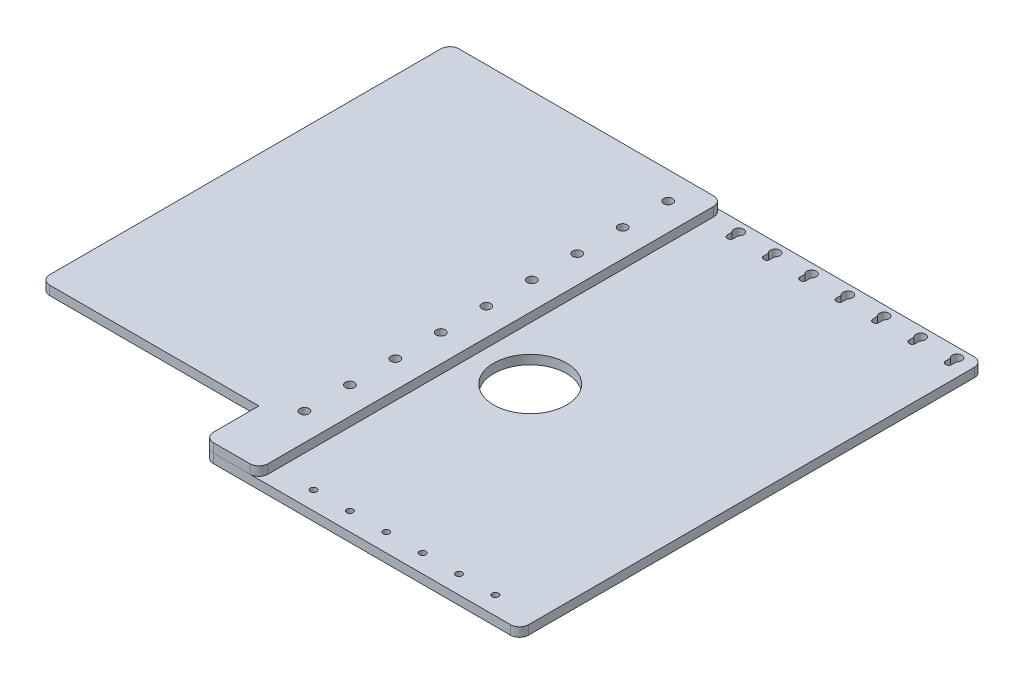
from build123d import *

# Parameters (mm, degrees)
SKETCH1_W                            = 173.27
SKETCH1_H                            = 255
SKETCH1_R                            = 20
PLATE_BODY_DEPTH                     = 5
EXTENSION_DEPTH                      = 5
EXTENSION_START                      = -10
SKETCH8_R                            = 2.5
EXTENSION_CONNECTOR_DEPTH            = 10
SKETCH15_R                           = 2.625
SKETCH15_W                           = 3.4
SKETCH15_H                           = 4.25
KEYHOLE_SLOT_BASE_DEPTH              = 5
KEYHOLE_R                            = 1.5
LPATTERN1_KEYHOLE_SLOTS_COUNT        = 7
LPATTERN1_KEYHOLE_SLOTS_PITCH        = 20
KEYHOLE_OF_LPATTERN1_KEYHOLE_SLOTS_R = 1.5
SKETCH16_R                           = 1.725
FRONT_MOUNTING_POINTS_DEPTH          = 5
PLATE_BODY_FILLET_R                  = 5
EXTENSION_FILLET_R                   = 5


with BuildPart() as part:
    # Sketch1 → Plate body (new body)
    with BuildSketch(Plane(origin=(0, 0, 0), x_dir=(1, 0, 0), z_dir=(0, 1, 0))):
        Rectangle(SKETCH1_W, SKETCH1_H)
        with Locations(Location((-27.5, -7.5, 0), (0, 0, 270))):
            Circle(SKETCH1_R, mode=Mode.SUBTRACT)
    extrude(amount=PLATE_BODY_DEPTH)


with BuildPart() as body_2:
    # Sketch2 → Extension (new body)
    with BuildSketch(Plane(origin=(0, 5, 0), x_dir=(1, 0, 0), z_dir=(0, 1, 0))):
        Polygon((-206.635, -97.5), (-86.635, -97.5), (-86.635, -127.5), (-56.635, -127.5), (-56.635, 127.5), (-206.635, 127.5), align=None)
    extrude(amount=EXTENSION_DEPTH)


with BuildPart() as extension_connector_tool:
    # Sketch8 → Extension connector (new body)
    with BuildSketch(Plane(origin=(0, 10, 0), x_dir=(1, 0, 0), z_dir=(0, 1, 0)).offset(EXTENSION_START)):
        with Locations(Location((-71.635, 112.5, 0), (0, 0, 270))):
            Circle(SKETCH8_R)
        with Locations(Location((-71.635, 87.5, 0), (0, 0, 270))):
            Circle(SKETCH8_R)
        with Locations(Location((-71.635, 62.5, 0), (0, 0, 270))):
            Circle(SKETCH8_R)
        with Locations(Location((-71.635, 37.5, 0), (0, 0, 270))):
            Circle(SKETCH8_R)
        with Locations(Location((-71.635, 12.5, 0), (0, 0, 270))):
            Circle(SKETCH8_R)
        with Locations(Location((-71.635, -12.5, 0), (0, 0, 270))):
            Circle(SKETCH8_R)
        with Locations(Location((-71.635, -37.5, 0), (0, 0, 270))):
            Circle(SKETCH8_R)
        with Locations(Location((-71.635, -62.5, 0), (0, 0, 270))):
            Circle(SKETCH8_R)
        with Locations(Location((-71.635, -87.5, 0), (0, 0, 270))):
            Circle(SKETCH8_R)
    extrude(amount=EXTENSION_CONNECTOR_DEPTH)


with BuildPart() as part_1:
    add(part.part)

    # Extension connector: cut by extension_connector_tool
    add(extension_connector_tool.part, mode=Mode.SUBTRACT)

    # Sketch15 → Keyhole slot base (cut)
    with BuildSketch(Plane(origin=(0, 0, 0), x_dir=(1, 0, 0), z_dir=(0, 1, 0))):
        with Locations((77.435, 122.250156244)):
            Circle(SKETCH15_R)
        with Locations((77.435, 118.125)):
            Rectangle(SKETCH15_W, SKETCH15_H)
    keyhole_slot_base = extrude(amount=KEYHOLE_SLOT_BASE_DEPTH, mode=Mode.SUBTRACT)

    # Keyhole
    keyhole_edges = [part_1.edges().sort_by_distance(p)[0] for p in [
        (75.735, 2.5, -116),
        (79.135, 2.5, -116),
    ]]
    fillet(keyhole_edges, radius=KEYHOLE_R)

    # LPattern1 keyhole slots: Keyhole slot base ×7
    with Locations(*[(-i * LPATTERN1_KEYHOLE_SLOTS_PITCH, 0, 0) for i in range(1, LPATTERN1_KEYHOLE_SLOTS_COUNT)]):
        add(keyhole_slot_base, mode=Mode.SUBTRACT)

    # Keyhole of LPattern1 keyhole slots
    keyhole_of_lpattern1_keyhole_slots_edges = [part_1.edges().sort_by_distance(p)[0] for p in [
        (55.735, 2.5, -116),
        (59.135, 2.5, -116),
        (35.735, 2.5, -116),
        (39.135, 2.5, -116),
        (15.735, 2.5, -116),
        (19.135, 2.5, -116),
        (-4.265, 2.5, -116),
        (-0.865, 2.5, -116),
        (-24.265, 2.5, -116),
        (-20.865, 2.5, -116),
        (-44.265, 2.5, -116),
        (-40.865, 2.5, -116),
    ]]
    fillet(keyhole_of_lpattern1_keyhole_slots_edges, radius=KEYHOLE_OF_LPATTERN1_KEYHOLE_SLOTS_R)

    # Sketch16 → Front mounting points (cut)
    with BuildSketch(Plane(origin=(0, 5, 0), x_dir=(1, 0, 0), z_dir=(0, 1, 0))):
        with Locations(Location((-36.635, -117.5, 0), (0, 0, 270))):
            Circle(SKETCH16_R)
        with Locations(Location((-16.635, -117.5, 0), (0, 0, 270))):
            Circle(SKETCH16_R)
        with Locations(Location((3.365, -117.5, 0), (0, 0, 270))):
            Circle(SKETCH16_R)
        with Locations(Location((23.365, -117.5, 0), (0, 0, 270))):
            Circle(SKETCH16_R)
        with Locations(Location((43.365, -117.5, 0), (0, 0, 270))):
            Circle(SKETCH16_R)
        with Locations(Location((63.365, -117.5, 0), (0, 0, 270))):
            Circle(SKETCH16_R)
    extrude(amount=-FRONT_MOUNTING_POINTS_DEPTH, mode=Mode.SUBTRACT)

    # Plate body fillet
    plate_body_fillet_edges = [part_1.edges().sort_by_distance(p)[0] for p in [
        (-86.635, 2.5, 127.5),
        (-86.635, 2.5, -127.5),
        (86.635, 2.5, -127.5),
        (86.635, 2.5, 127.5),
    ]]
    fillet(plate_body_fillet_edges, radius=PLATE_BODY_FILLET_R)


with BuildPart() as body_2_1:
    add(body_2.part)

    # Extension connector: cut by extension_connector_tool
    add(extension_connector_tool.part, mode=Mode.SUBTRACT)

    # Extension fillet
    extension_fillet_edges = [body_2_1.edges().sort_by_distance(p)[0] for p in [
        (-206.635, 7.5, -127.5),
        (-56.635, 7.5, -127.5),
        (-56.635, 7.5, 127.5),
        (-86.635, 7.5, 127.5),
        (-206.635, 7.5, 97.5),
    ]]
    fillet(extension_fillet_edges, radius=EXTENSION_FILLET_R)


solid = Compound([part_1.part, body_2_1.part])
